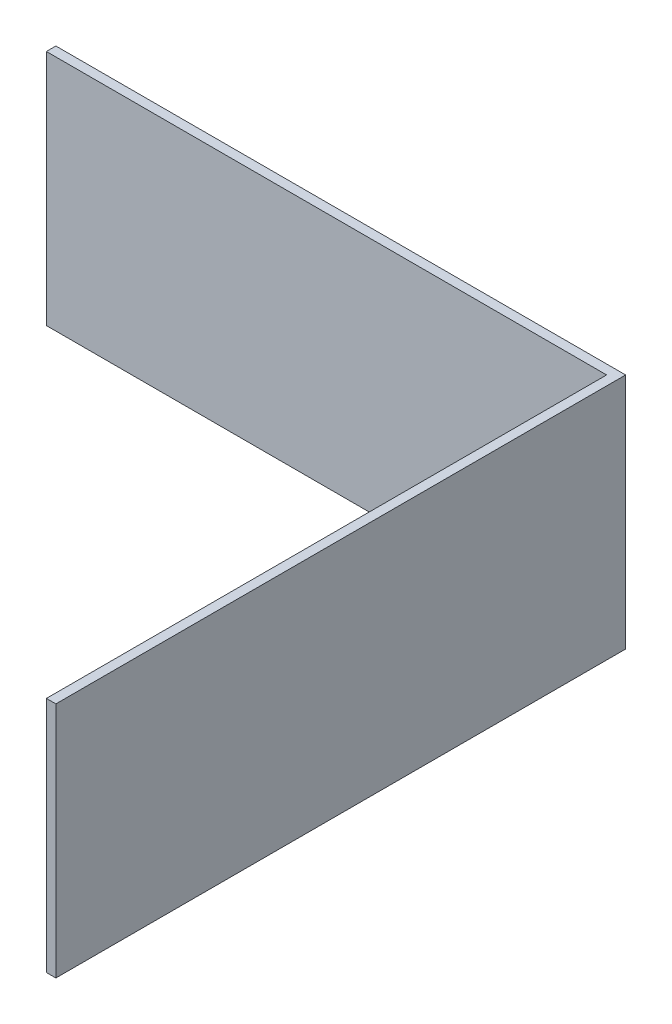
from build123d import *

# Parameters (mm, degrees)
CROQUIS1_W     = 6000
CROQUIS1_H     = 6000
EXTRUIR1_DEPTH = 20
EXTRUIR2_DEPTH = 2500


with BuildPart() as part:
    # Croquis1 → Extruir1 (new body)
    with BuildSketch(Plane(origin=(0, 0, 0), x_dir=(1, 0, 0), z_dir=(0, 1, 0))):
        Rectangle(CROQUIS1_W, CROQUIS1_H)
    extrude(amount=EXTRUIR1_DEPTH)


with BuildPart() as body_2:
    # Croquis2 → Extruir2 (new body)
    with BuildSketch(Plane(origin=(0, 20, 0), x_dir=(1, 0, 0), z_dir=(0, 1, 0))):
        Polygon((3000, 3000), (-3000, 3000), (-3000, 2900), (2900, 2900), (2900, -3000), (3000, -3000), align=None)
    extrude(amount=EXTRUIR2_DEPTH)


solid = body_2.part
